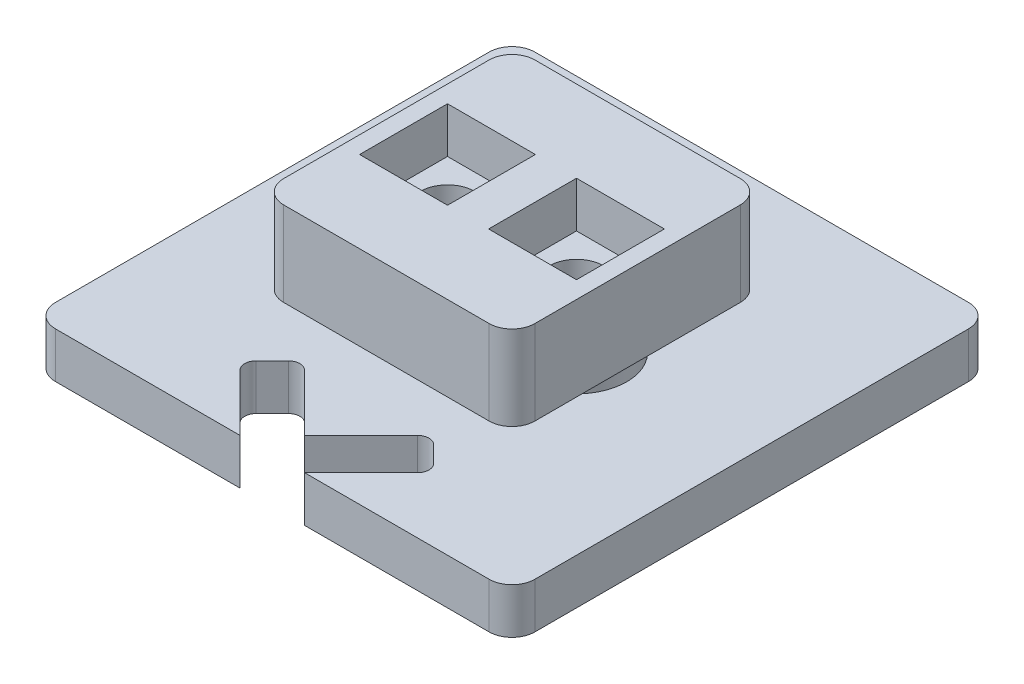
from build123d import *
from build123d.topology import SkipClean

# Parameters (mm, degrees)
SKETCH1_W           = 11
SKETCH1_H           = 11
BOSS_EXTRUDE1_DEPTH = 3.7
FILLET1_R           = 1
SKETCH2_W           = 3.85
SKETCH2_H           = 3.85
CUT_EXTRUDE1_DEPTH  = 2
SKETCH4_R           = 2.2
BOSS_EXTRUDE2_DEPTH = 3
BOSS_EXTRUDE3_DEPTH = 2
SKETCH3_R           = 1.2
CUT_EXTRUDE2_DEPTH  = 17.290794947
CUT_EXTRUDE3_DEPTH  = 16.57530096
SKETCH8_R           = 2.2
SKETCH8_R_2         = 1.2
BOSS_EXTRUDE4_DEPTH = 4


with BuildPart() as part:
    # Sketch1 → Boss-Extrude1 (new body)
    with BuildSketch(Plane(origin=(0, 0, 0), x_dir=(1, 0, 0), z_dir=(0, 1, 0))):
        Rectangle(SKETCH1_W, SKETCH1_H)
    extrude(amount=BOSS_EXTRUDE1_DEPTH)

    # Fillet1
    fillet1_edges = [part.edges().sort_by_distance(p)[0] for p in [
        (5.5, 1.85, 5.5),
        (-5.5, 1.85, 5.5),
        (-5.5, 1.85, -5.5),
        (5.5, 1.85, -5.5),
    ]]
    fillet(fillet1_edges, radius=FILLET1_R)

    # Sketch2 → Cut-Extrude1 (cut)
    with BuildSketch(Plane(origin=(0, 3.7, 0), x_dir=(1, 0, 0), z_dir=(0, 1, 0))):
        with Locations((-2.825, 0)):
            Rectangle(SKETCH2_W, SKETCH2_H)
        with Locations((2.825, 0)):
            Rectangle(SKETCH2_W, SKETCH2_H)
    extrude(amount=-CUT_EXTRUDE1_DEPTH, mode=Mode.SUBTRACT)

    # Sketch4 → Boss-Extrude2 (add)
    with BuildSketch(Plane(origin=(0, 0, 0), x_dir=(-1, 0, 0), z_dir=(0, -1, 0))):
        with Locations(Location((2.825, 0, 0), (0, 0, 90))):
            Circle(SKETCH4_R)
        with Locations(Location((-2.825, 0, 0), (0, 0, 90))):
            Circle(SKETCH4_R)
    extrude(amount=BOSS_EXTRUDE2_DEPTH)

    # Sketch5 → Boss-Extrude3 (add)
    with BuildSketch(Plane(origin=(0, -3, 0), x_dir=(-1, 0, 0), z_dir=(0, -1, 0))):
        with BuildLine():
            Line((9.5, 10.5), (-9.5, 10.5))
            ThreePointArc((-9.5, 10.5), (-10.207106781, 10.207106781), (-10.5, 9.5))
            Line((-10.5, 9.5), (-10.5, -9.5))
            ThreePointArc((-10.5, -9.5), (-10.207106781, -10.207106781), (-9.5, -10.5))
            Line((-9.5, -10.5), (9.5, -10.5))
            ThreePointArc((9.5, -10.5), (10.207106781, -10.207106781), (10.5, -9.5))
            Line((10.5, -9.5), (10.5, 9.5))
            ThreePointArc((10.5, 9.5), (10.207106781, 10.207106781), (9.5, 10.5))
        make_face()
    extrude(amount=-BOSS_EXTRUDE3_DEPTH)

    # Sketch3 → Cut-Extrude2 (cut, through all)
    with BuildSketch(Plane(origin=(0, 3.7, 0), x_dir=(1, 0, 0), z_dir=(0, 1, 0))):
        with Locations(Location((-2.825, 0, 0), (0, 0, 270))):
            Circle(SKETCH3_R)
        with Locations(Location((2.825, 0, 0), (0, 0, 270))):
            Circle(SKETCH3_R)
    extrude(amount=-CUT_EXTRUDE2_DEPTH, mode=Mode.SUBTRACT)

    # Sketch7 → Cut-Extrude3 (cut, through all)
    with BuildSketch(Plane(origin=(0, -1, 0), x_dir=(1, 0, 0), z_dir=(0, 1, 0))):
        with BuildLine():
            Line((0, -9.085786438), (1.414213562, -10.5))
            Line((1.414213562, -10.5), (3.889087297, -8.025126266))
            ThreePointArc((3.889087297, -8.025126266), (4.035533906, -7.671572875), (3.889087297, -7.318019485))
            Line((3.889087297, -7.318019485), (3.181980515, -6.610912703))
            ThreePointArc((3.181980515, -6.610912703), (2.828427125, -6.464466094), (2.474873734, -6.610912703))
            Line((2.474873734, -6.610912703), (0, -9.085786438))
        make_face()
        with BuildLine():
            Line((-3.889087297, -8.025126266), (-1.414213562, -10.5))
            Line((-1.414213562, -10.5), (0, -9.085786438))
            Line((0, -9.085786438), (-2.474873734, -6.610912703))
            ThreePointArc((-2.474873734, -6.610912703), (-2.828427125, -6.464466094), (-3.181980515, -6.610912703))
            Line((-3.181980515, -6.610912703), (-3.889087297, -7.318019485))
            ThreePointArc((-3.889087297, -7.318019485), (-4.035533906, -7.671572875), (-3.889087297, -8.025126266))
        make_face()
        Polygon((-1.414213562, -10.5), (1.414213562, -10.5), (0, -9.085786438), align=None)
    extrude(amount=-CUT_EXTRUDE3_DEPTH, mode=Mode.SUBTRACT)

    # Sketch8 → Boss-Extrude4 (add)
    # profile 1 of 2: a face of its own
    with SkipClean():  # the faces are left unmerged after this step: merging them gives an invalid solid
        with BuildSketch(Plane.XZ.offset(3)):
            with Locations(Location((-2.825, 0, 0), (0, 0, 90))):
                Circle(SKETCH8_R)
            with Locations(Location((-2.825, 0, 0), (0, 0, 270))):
                Circle(SKETCH8_R_2, mode=Mode.SUBTRACT)
        # profile 2 of 2: a face of its own
        with BuildSketch(Plane.XZ.offset(3)):
            with Locations(Location((2.825, 0, 0), (0, 0, 90))):
                Circle(SKETCH8_R)
            with Locations(Location((2.825, 0, 0), (0, 0, 270))):
                Circle(SKETCH8_R_2, mode=Mode.SUBTRACT)
        extrude(amount=BOSS_EXTRUDE4_DEPTH)


solid = part.part
